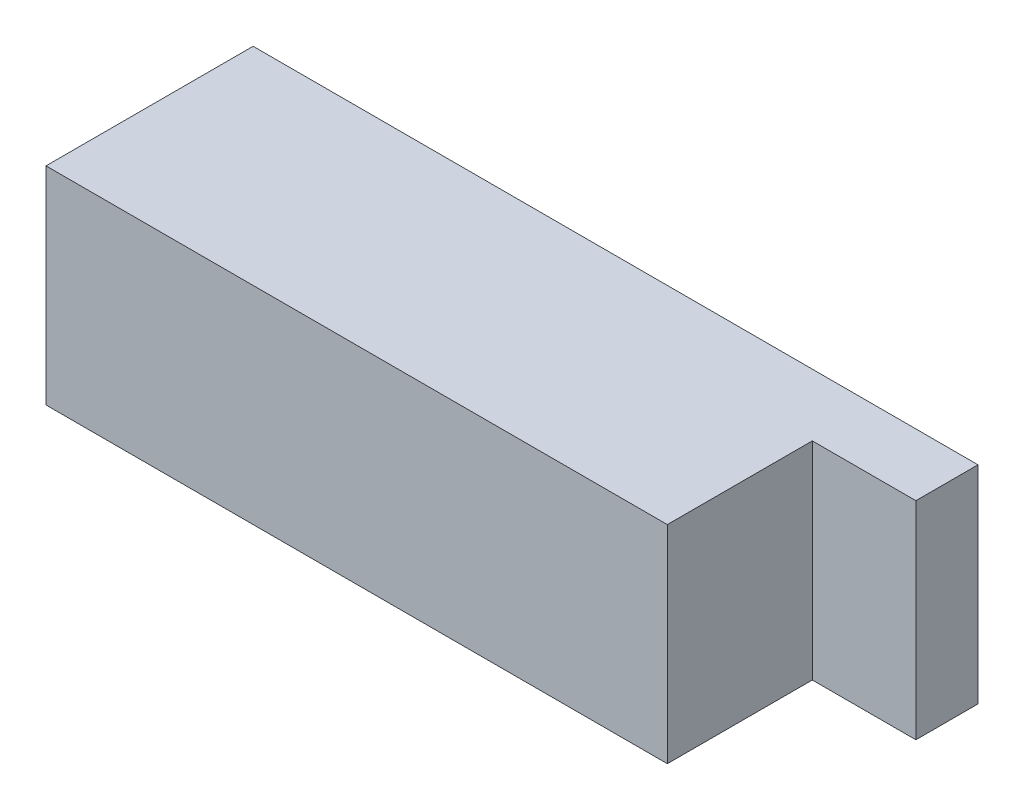
from build123d import *

# Parameters (mm, degrees)
SKETCH1_W           = 35
SKETCH1_H           = 10
BOSS_EXTRUDE1_DEPTH = 10
CUT_EXTRUDE2_REACH  = 22.767
SKETCH3_W           = 5
SKETCH3_H           = 7


with BuildPart() as part:
    # Sketch1 → Boss-Extrude1 (new body)
    with BuildSketch(Plane(origin=(0, 0, 0), x_dir=(1, 0, 0), z_dir=(0, 1, 0))):
        Rectangle(SKETCH1_W, SKETCH1_H)
    extrude(amount=BOSS_EXTRUDE1_DEPTH)

    # Sketch3 → Cut-Extrude2 (cut, up to next)
    with BuildSketch(Plane(origin=(0, 10, 0), x_dir=(1, 0, 0), z_dir=(0, 1, 0)), mode=Mode.PRIVATE) as cut_extrude2_sk1:
        with Locations((15, -1.5)):
            Rectangle(SKETCH3_W, SKETCH3_H)
    cut_extrude2_tool1 = extrude(cut_extrude2_sk1.sketch, amount=-CUT_EXTRUDE2_REACH, mode=Mode.PRIVATE) & part.part
    add(cut_extrude2_tool1.solids().sort_by_distance((15, 10, 1.5))[0], mode=Mode.SUBTRACT)


solid = part.part
